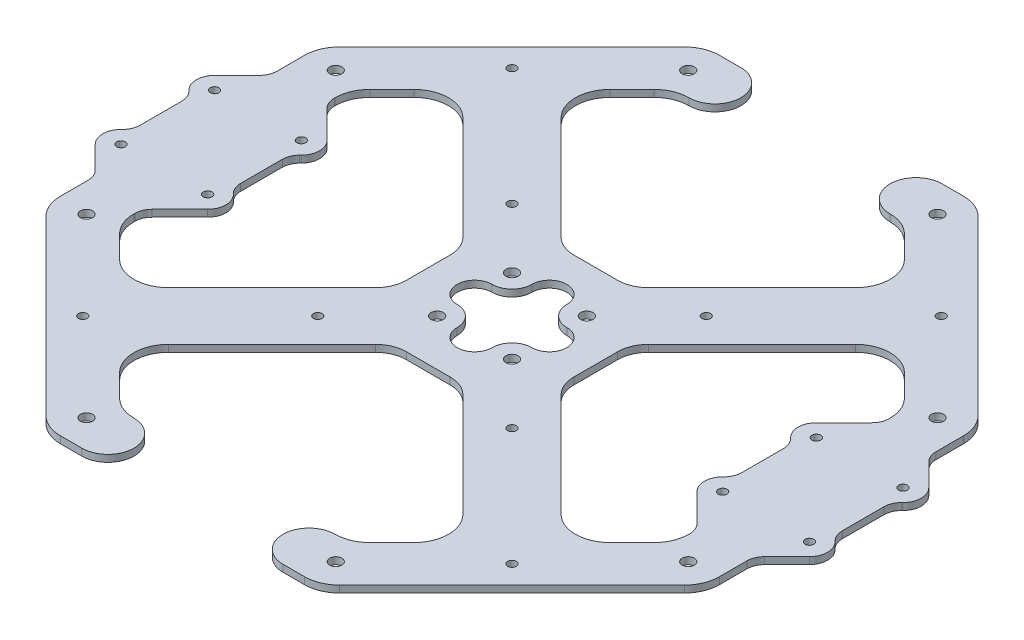
from build123d import *

# Parameters (mm, degrees)
SKETCH2_R           = 1.25
SKETCH2_R_2         = 1.75
BOSS_EXTRUDE1_DEPTH = 2


with BuildPart() as part:
    # Sketch2 → Boss-Extrude1 (new body)
    with BuildSketch(Plane(origin=(0, 0, 0), x_dir=(1, 0, 0), z_dir=(0, 1, 0))):
        with BuildLine():
            Line((36.066017178, 77.071067812), (42.426406871, 70.710678119))
            ThreePointArc((42.426406871, 70.710678119), (45.355339059, 63.639610307), (42.426406871, 56.568542495))
            Line((42.426406871, 56.568542495), (12.63528481, 26.777420433))
            ThreePointArc((12.63528481, 26.777420433), (9.716310016, 24.827023831), (6.273144482, 24.142135624))
            Line((6.273144482, 24.142135624), (-6.273144482, 24.142135624))
            ThreePointArc((-6.273144482, 24.142135624), (-9.716310016, 24.827023831), (-12.63528481, 26.777420433))
            Line((-12.63528481, 26.777420433), (-42.426406871, 56.568542495))
            ThreePointArc((-42.426406871, 56.568542495), (-45.355339059, 63.639610307), (-42.426406871, 70.710678119))
            Line((-42.426406871, 70.710678119), (-36.066017178, 77.071067812))
            ThreePointArc((-36.066017178, 77.071067812), (-32.82178369, 79.238795325), (-28.994949366, 80))
            ThreePointArc((-28.994949366, 80), (-21.494949366, 87.5), (-28.994949366, 95))
            Line((-28.994949366, 95), (-35.208152802, 95))
            ThreePointArc((-35.208152802, 95), (-39.034987125, 94.238795325), (-42.279220614, 92.071067812))
            Line((-42.279220614, 92.071067812), (-92.071067812, 42.279220614))
            ThreePointArc((-92.071067812, 42.279220614), (-94.238795325, 39.034987125), (-95, 35.208152802))
            Line((-95, 35.208152802), (-95, 27.234484339))
            ThreePointArc((-95, 27.234484339), (-95.380602337, 25.321067178), (-96.464466094, 23.698950434))
            Line((-96.464466094, 23.698950434), (-102.951105926, 17.212310601))
            ThreePointArc((-102.951105926, 17.212310601), (-104.488795325, 13.5), (-102.951105926, 9.787689399))
            Line((-102.951105926, 9.787689399), (-102.703261419, 9.539844892))
            ThreePointArc((-102.703261419, 9.539844892), (-101.619397663, 7.917728148), (-101.238795325, 6.004310986))
            Line((-101.238795325, 6.004310986), (-101.238795325, -6.004310986))
            ThreePointArc((-101.238795325, -6.004310986), (-101.619397663, -7.917728148), (-102.703261419, -9.539844892))
            Line((-102.703261419, -9.539844892), (-102.951105926, -9.787689399))
            ThreePointArc((-102.951105926, -9.787689399), (-104.488795325, -13.5), (-102.951105926, -17.212310601))
            Line((-102.951105926, -17.212310601), (-96.464466094, -23.698950434))
            ThreePointArc((-96.464466094, -23.698950434), (-95.380602337, -25.321067178), (-95, -27.234484339))
            Line((-95, -27.234484339), (-95, -35.208152802))
            ThreePointArc((-95, -35.208152802), (-94.238795325, -39.034987125), (-92.071067812, -42.279220614))
            Line((-92.071067812, -42.279220614), (-42.279220614, -92.071067812))
            ThreePointArc((-42.279220614, -92.071067812), (-39.034987125, -94.238795325), (-35.208152802, -95))
            Line((-35.208152802, -95), (-28.994949366, -95))
            ThreePointArc((-28.994949366, -95), (-21.494949366, -87.5), (-28.994949366, -80))
            ThreePointArc((-28.994949366, -80), (-32.82178369, -79.238795325), (-36.066017178, -77.071067812))
            Line((-36.066017178, -77.071067812), (-42.426406871, -70.710678119))
            ThreePointArc((-42.426406871, -70.710678119), (-45.355339059, -63.639610307), (-42.426406871, -56.568542495))
            Line((-42.426406871, -56.568542495), (-12.63528481, -26.777420433))
            ThreePointArc((-12.63528481, -26.777420433), (-9.716310016, -24.827023831), (-6.273144482, -24.142135624))
            Line((-6.273144482, -24.142135624), (6.273144482, -24.142135624))
            ThreePointArc((6.273144482, -24.142135624), (9.716310016, -24.827023831), (12.63528481, -26.777420433))
            Line((12.63528481, -26.777420433), (42.426406871, -56.568542495))
            ThreePointArc((42.426406871, -56.568542495), (45.355339059, -63.639610307), (42.426406871, -70.710678119))
            Line((42.426406871, -70.710678119), (36.066017178, -77.071067812))
            ThreePointArc((36.066017178, -77.071067812), (32.82178369, -79.238795325), (28.994949366, -80))
            ThreePointArc((28.994949366, -80), (21.494949366, -87.5), (28.994949366, -95))
            Line((28.994949366, -95), (35.208152802, -95))
            ThreePointArc((35.208152802, -95), (39.034987125, -94.238795325), (42.279220614, -92.071067812))
            Line((42.279220614, -92.071067812), (92.071067812, -42.279220614))
            ThreePointArc((92.071067812, -42.279220614), (94.238795325, -39.034987125), (95, -35.208152802))
            Line((95, -35.208152802), (95, -27.234484339))
            ThreePointArc((95, -27.234484339), (95.380602337, -25.321067178), (96.464466094, -23.698950434))
            Line((96.464466094, -23.698950434), (102.951105926, -17.212310601))
            ThreePointArc((102.951105926, -17.212310601), (104.488795325, -13.5), (102.951105926, -9.787689399))
            Line((102.951105926, -9.787689399), (102.703261419, -9.539844892))
            ThreePointArc((102.703261419, -9.539844892), (101.619397663, -7.917728148), (101.238795325, -6.004310986))
            Line((101.238795325, -6.004310986), (101.238795325, 6.004310986))
            ThreePointArc((101.238795325, 6.004310986), (101.619397663, 7.917728148), (102.703261419, 9.539844892))
            Line((102.703261419, 9.539844892), (102.951105926, 9.787689399))
            ThreePointArc((102.951105926, 9.787689399), (104.488795325, 13.5), (102.951105926, 17.212310601))
            Line((102.951105926, 17.212310601), (96.464466094, 23.698950434))
            ThreePointArc((96.464466094, 23.698950434), (95.380602337, 25.321067178), (95, 27.234484339))
            Line((95, 27.234484339), (95, 35.208152802))
            ThreePointArc((95, 35.208152802), (94.238795325, 39.034987125), (92.071067812, 42.279220614))
            Line((92.071067812, 42.279220614), (42.279220614, 92.071067812))
            ThreePointArc((42.279220614, 92.071067812), (39.034987125, 94.238795325), (35.208152802, 95))
            Line((35.208152802, 95), (28.994949366, 95))
            ThreePointArc((28.994949366, 95), (21.494949366, 87.5), (28.994949366, 80))
            ThreePointArc((28.994949366, 80), (32.82178369, 79.238795325), (36.066017178, 77.071067812))
        make_face()
        with Locations(Location((-61.871843354, -61.871843354, 0), (0, 0, 270))):
            Circle(SKETCH2_R, mode=Mode.SUBTRACT)
        with Locations(Location((-35.928385408, -86.738795325, 0), (0, 0, 270))):
            Circle(SKETCH2_R_2, mode=Mode.SUBTRACT)
        with Locations(Location((-86.738795325, -35.928385408, 0), (0, 0, 270))):
            Circle(SKETCH2_R_2, mode=Mode.SUBTRACT)
        with Locations(Location((-99.238795325, -13.5, 0), (0, 0, 270))):
            Circle(SKETCH2_R, mode=Mode.SUBTRACT)
        with Locations(Location((-74.238795325, -13.5, 0), (0, 0, 270))):
            Circle(SKETCH2_R, mode=Mode.SUBTRACT)
        with BuildLine():
            Line((-77.071067812, 36.066017178), (-70.710678119, 42.426406871))
            ThreePointArc((-70.710678119, 42.426406871), (-63.639610307, 45.355339059), (-56.568542495, 42.426406871))
            Line((-56.568542495, 42.426406871), (-26.777420433, 12.63528481))
            ThreePointArc((-26.777420433, 12.63528481), (-24.827023831, 9.716310016), (-24.142135624, 6.273144482))
            Line((-24.142135624, 6.273144482), (-24.142135624, -6.273144482))
            ThreePointArc((-24.142135624, -6.273144482), (-24.827023831, -9.716310016), (-26.777420433, -12.63528481))
            Line((-26.777420433, -12.63528481), (-56.568542495, -42.426406871))
            ThreePointArc((-56.568542495, -42.426406871), (-63.639610307, -45.355339059), (-70.710678119, -42.426406871))
            Line((-70.710678119, -42.426406871), (-77.071067812, -36.066017178))
            ThreePointArc((-77.071067812, -36.066017178), (-79.238795325, -32.82178369), (-80, -28.994949366))
            Line((-80, -28.994949366), (-80, -28.756893689))
            ThreePointArc((-80, -28.756893689), (-79.619397663, -26.843476527), (-78.535533906, -25.221359783))
            Line((-78.535533906, -25.221359783), (-70.526484724, -17.212310601))
            ThreePointArc((-70.526484724, -17.212310601), (-68.988795325, -13.5), (-70.526484724, -9.787689399))
            Line((-70.526484724, -9.787689399), (-70.774329231, -9.539844892))
            ThreePointArc((-70.774329231, -9.539844892), (-71.858192988, -7.917728148), (-72.238795325, -6.004310986))
            Line((-72.238795325, -6.004310986), (-72.238795325, 6.004310986))
            ThreePointArc((-72.238795325, 6.004310986), (-71.858192988, 7.917728148), (-70.774329231, 9.539844892))
            Line((-70.774329231, 9.539844892), (-70.526484724, 9.787689399))
            ThreePointArc((-70.526484724, 9.787689399), (-68.988795325, 13.5), (-70.526484724, 17.212310601))
            Line((-70.526484724, 17.212310601), (-78.535533906, 25.221359783))
            ThreePointArc((-78.535533906, 25.221359783), (-79.619397663, 26.843476527), (-80, 28.756893689))
            Line((-80, 28.756893689), (-80, 28.994949366))
            ThreePointArc((-80, 28.994949366), (-79.238795325, 32.82178369), (-77.071067812, 36.066017178))
        make_face(mode=Mode.SUBTRACT)
        with Locations(Location((-28, -28, 0), (0, 0, 270))):
            Circle(SKETCH2_R, mode=Mode.SUBTRACT)
        with Locations(Location((-10.783378413, -10.783378413, 0), (0, 0, 270))):
            Circle(SKETCH2_R_2, mode=Mode.SUBTRACT)
        with Locations(Location((35.928385408, -86.738795325, 0), (0, 0, 270))):
            Circle(SKETCH2_R_2, mode=Mode.SUBTRACT)
        with Locations(Location((61.871843354, -61.871843354, 0), (0, 0, 270))):
            Circle(SKETCH2_R, mode=Mode.SUBTRACT)
        with Locations(Location((28, -28, 0), (0, 0, 270))):
            Circle(SKETCH2_R, mode=Mode.SUBTRACT)
        with Locations(Location((10.783378413, -10.783378413, 0), (0, 0, 270))):
            Circle(SKETCH2_R_2, mode=Mode.SUBTRACT)
        with BuildLine():
            ThreePointArc((-10.783378413, 5.033378413), (-6.717514421, 6.717514421), (-5.033378413, 10.783378413))
            ThreePointArc((-5.033378413, 10.783378413), (0, 15.816756826), (5.033378413, 10.783378413))
            ThreePointArc((5.033378413, 10.783378413), (6.717514421, 6.717514421), (10.783378413, 5.033378413))
            ThreePointArc((10.783378413, 5.033378413), (15.816756826, 0), (10.783378413, -5.033378413))
            ThreePointArc((10.783378413, -5.033378413), (6.717514421, -6.717514421), (5.033378413, -10.783378413))
            ThreePointArc((5.033378413, -10.783378413), (0, -15.816756826), (-5.033378413, -10.783378413))
            ThreePointArc((-5.033378413, -10.783378413), (-6.717514421, -6.717514421), (-10.783378413, -5.033378413))
            ThreePointArc((-10.783378413, -5.033378413), (-15.816756826, 0), (-10.783378413, 5.033378413))
        make_face(mode=Mode.SUBTRACT)
        with Locations(Location((86.738795325, -35.928385408, 0), (0, 0, 270))):
            Circle(SKETCH2_R_2, mode=Mode.SUBTRACT)
        with Locations(Location((74.238795325, -13.5, 0), (0, 0, 90))):
            Circle(SKETCH2_R, mode=Mode.SUBTRACT)
        with BuildLine():
            Line((77.071067812, -36.066017178), (70.710678119, -42.426406871))
            ThreePointArc((70.710678119, -42.426406871), (63.639610307, -45.355339059), (56.568542495, -42.426406871))
            Line((56.568542495, -42.426406871), (26.777420433, -12.63528481))
            ThreePointArc((26.777420433, -12.63528481), (24.827023831, -9.716310016), (24.142135624, -6.273144482))
            Line((24.142135624, -6.273144482), (24.142135624, 6.273144482))
            ThreePointArc((24.142135624, 6.273144482), (24.827023831, 9.716310016), (26.777420433, 12.63528481))
            Line((26.777420433, 12.63528481), (56.568542495, 42.426406871))
            ThreePointArc((56.568542495, 42.426406871), (63.639610307, 45.355339059), (70.710678119, 42.426406871))
            Line((70.710678119, 42.426406871), (77.071067812, 36.066017178))
            ThreePointArc((77.071067812, 36.066017178), (79.238795325, 32.82178369), (80, 28.994949366))
            Line((80, 28.994949366), (80, 28.756893689))
            ThreePointArc((80, 28.756893689), (79.619397663, 26.843476527), (78.535533906, 25.221359783))
            Line((78.535533906, 25.221359783), (70.526484724, 17.212310601))
            ThreePointArc((70.526484724, 17.212310601), (68.988795325, 13.5), (70.526484724, 9.787689399))
            Line((70.526484724, 9.787689399), (70.774329231, 9.539844892))
            ThreePointArc((70.774329231, 9.539844892), (71.858192988, 7.917728148), (72.238795325, 6.004310986))
            Line((72.238795325, 6.004310986), (72.238795325, -6.004310986))
            ThreePointArc((72.238795325, -6.004310986), (71.858192988, -7.917728148), (70.774329231, -9.539844892))
            Line((70.774329231, -9.539844892), (70.526484724, -9.787689399))
            ThreePointArc((70.526484724, -9.787689399), (68.988795325, -13.5), (70.526484724, -17.212310601))
            Line((70.526484724, -17.212310601), (78.535533906, -25.221359783))
            ThreePointArc((78.535533906, -25.221359783), (79.619397663, -26.843476527), (80, -28.756893689))
            Line((80, -28.756893689), (80, -28.994949366))
            ThreePointArc((80, -28.994949366), (79.238795325, -32.82178369), (77.071067812, -36.066017178))
        make_face(mode=Mode.SUBTRACT)
        with Locations(Location((99.238795325, -13.5, 0), (0, 0, 90))):
            Circle(SKETCH2_R, mode=Mode.SUBTRACT)
        with Locations(Location((-99.238795325, 13.5, 0), (0, 0, 90))):
            Circle(SKETCH2_R, mode=Mode.SUBTRACT)
        with Locations(Location((-74.238795325, 13.5, 0), (0, 0, 90))):
            Circle(SKETCH2_R, mode=Mode.SUBTRACT)
        with Locations(Location((-86.738795325, 35.928385408, 0), (0, 0, 270))):
            Circle(SKETCH2_R_2, mode=Mode.SUBTRACT)
        with Locations(Location((-10.783378413, 10.783378413, 0), (0, 0, 270))):
            Circle(SKETCH2_R_2, mode=Mode.SUBTRACT)
        with Locations(Location((-28, 28, 0), (0, 0, 270))):
            Circle(SKETCH2_R, mode=Mode.SUBTRACT)
        with Locations(Location((-61.871843354, 61.871843354, 0), (0, 0, 270))):
            Circle(SKETCH2_R, mode=Mode.SUBTRACT)
        with Locations(Location((-35.928385408, 86.738795325, 0), (0, 0, 270))):
            Circle(SKETCH2_R_2, mode=Mode.SUBTRACT)
        with Locations(Location((10.783378413, 10.783378413, 0), (0, 0, 270))):
            Circle(SKETCH2_R_2, mode=Mode.SUBTRACT)
        with Locations(Location((28, 28, 0), (0, 0, 270))):
            Circle(SKETCH2_R, mode=Mode.SUBTRACT)
        with Locations(Location((99.238795325, 13.5, 0), (0, 0, 270))):
            Circle(SKETCH2_R, mode=Mode.SUBTRACT)
        with Locations(Location((86.738795325, 35.928385408, 0), (0, 0, 270))):
            Circle(SKETCH2_R_2, mode=Mode.SUBTRACT)
        with Locations(Location((35.928385408, 86.738795325, 0), (0, 0, 270))):
            Circle(SKETCH2_R_2, mode=Mode.SUBTRACT)
        with Locations(Location((61.871843354, 61.871843354, 0), (0, 0, 270))):
            Circle(SKETCH2_R, mode=Mode.SUBTRACT)
        with Locations(Location((74.238795325, 13.5, 0), (0, 0, 270))):
            Circle(SKETCH2_R, mode=Mode.SUBTRACT)
    extrude(amount=BOSS_EXTRUDE1_DEPTH)


solid = part.part
